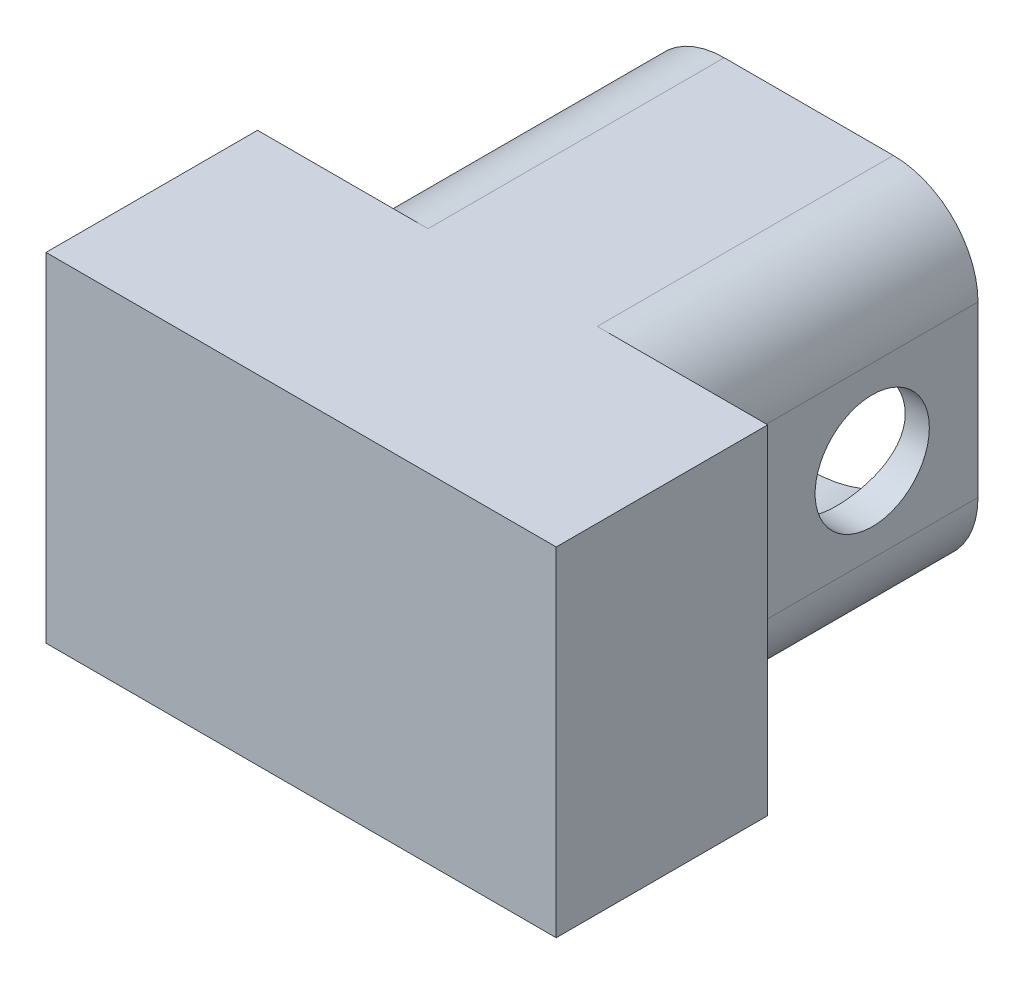
from build123d import *

# Parameters (mm, degrees)
SKETCH_1_W             = 8
SKETCH_1_H             = 8
EXTRUDE_1_DEPTH        = 7
SKETCH_1_3_OUTSIDE_W   = 12.66
SKETCH_1_3_OUTSIDE_H   = 12.66
SKETCH_1_3_OUTSIDE_W_2 = 8
SKETCH_1_3_OUTSIDE_H_2 = 8
SKETCH_1_3_OUTSIDE_R   = 3.43
CUT_EXTRUDE_1_DEPTH    = 6
SKETCH_4_R             = 1.35
CUT_EXTRUDE_2_DEPTH    = 12.6
SKETCH_8_W             = 12.06
SKETCH_8_H             = 8
EXTRUDE_3_DEPTH        = 5
FILLET_1_R             = 2


with BuildPart() as part:
    # 스케치1 → 보스-돌출1 (new body)
    with BuildSketch(Plane.XY):
        Rectangle(SKETCH_1_W, SKETCH_1_H)
    extrude(amount=EXTRUDE_1_DEPTH)

    # 스케치1<3> outside → 컷-돌출1 (cut)
    # profile 1 of 2: a face of its own
    with BuildSketch(Plane.XY):
        Rectangle(SKETCH_1_3_OUTSIDE_W, SKETCH_1_3_OUTSIDE_H)
        Rectangle(SKETCH_1_3_OUTSIDE_W_2, SKETCH_1_3_OUTSIDE_H_2, mode=Mode.SUBTRACT)
    # profile 2 of 2: a face of its own
    with BuildSketch(Plane.XY):
        Circle(SKETCH_1_3_OUTSIDE_R)
    extrude(amount=CUT_EXTRUDE_1_DEPTH, mode=Mode.SUBTRACT)

    # 스케치4 → 컷-돌출2 (cut)
    with BuildSketch(Plane(origin=(4, 0, 0), x_dir=(0, 0, -1), z_dir=(1, 0, 0))):
        with Locations((-2.5, 0)):
            Circle(SKETCH_4_R)
    extrude(amount=-CUT_EXTRUDE_2_DEPTH, mode=Mode.SUBTRACT)

    # 스케치8 → 보스-돌출3 (add)
    with BuildSketch(Plane.XY.offset(7)):
        Rectangle(SKETCH_8_W, SKETCH_8_H)
    extrude(amount=EXTRUDE_3_DEPTH)

    # 필렛1
    fillet_1_edges = [part.edges().sort_by_distance(p)[0] for p in [
        (-4, -4, 3.5),
        (4, -4, 3.5),
        (4, 4, 3.5),
        (-4, 4, 3.5),
    ]]
    fillet(fillet_1_edges, radius=FILLET_1_R)


solid = part.part
